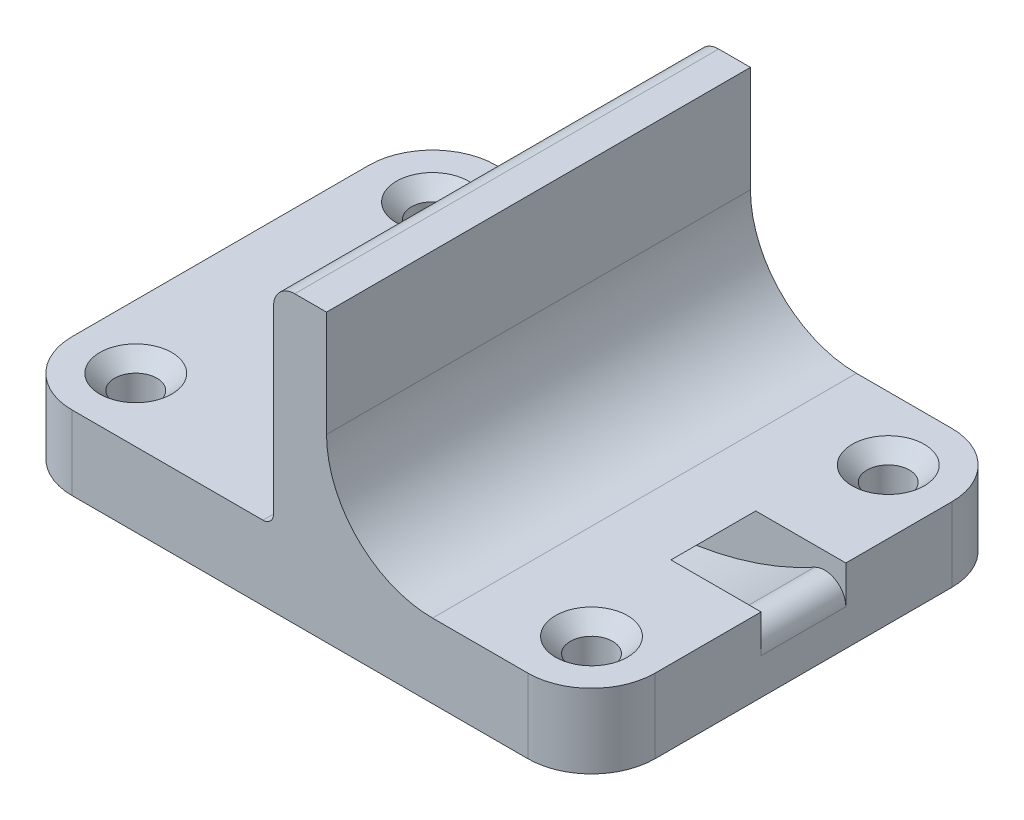
from build123d import *

# Parameters (mm, degrees)
BOSS_EXTRUDE1_DEPTH     = 40
CUT_EXTRUDE1_DEPTH      = 4
CUT_EXTRUDE1_DEPTH_BACK = 4
CUT_EXTRUDE1_START      = -20
SKETCH3_R               = 33.884102156
SKETCH3_R_2             = 29.884102156
FILLET1_R               = 2
FILLET2_R               = 2
FILLET3_R               = 2
SKETCH4_R               = 2
CUT_EXTRUDE2_DEPTH      = 7
CHAMFER1_SIZE           = 1.4
FILLET4_R               = 1
FILLET5_R               = 10
FILLET6_R               = 6


with BuildPart() as part:
    # Sketch1 → Boss-Extrude1 (new body)
    with BuildSketch(Plane.XY):
        Polygon((0, 0), (0, 20), (-5, 20), (-5, 0), (-30, 0), (-30, -7), (25, -7), (25, 0), align=None)
    extrude(amount=BOSS_EXTRUDE1_DEPTH)

    # Sketch3 → Cut-Extrude1 (cut, two sides: drawn at the far end of the back side and taken through both)
    with BuildSketch(Plane.XY.offset(40).offset(CUT_EXTRUDE1_START - CUT_EXTRUDE1_DEPTH_BACK)):
        with Locations((5.748786379, 27.884102156)):
            Circle(SKETCH3_R)
        with Locations((5.748786379, 27.884102156)):
            Circle(SKETCH3_R_2, mode=Mode.SUBTRACT)
    extrude(amount=CUT_EXTRUDE1_DEPTH + CUT_EXTRUDE1_DEPTH_BACK, mode=Mode.SUBTRACT)

    # Fillet1
    fillet1_edges = [part.edges().sort_by_distance(p)[0] for p in [
        (-5, 0, 20),
    ]]
    fillet(fillet1_edges, radius=FILLET1_R)

    # Fillet2
    fillet2_edges = [part.edges().sort_by_distance(p)[0] for p in [
        (-5, 20, 20),
    ]]
    fillet(fillet2_edges, radius=FILLET2_R)

    # Fillet3
    fillet3_edges = [part.edges().sort_by_distance(p)[0] for p in [
        (25, 0, 20),
    ]]
    fillet(fillet3_edges, radius=FILLET3_R)

    # Sketch4 → Cut-Extrude2 (cut)
    with BuildSketch(Plane(origin=(0, 0, 0), x_dir=(1, 0, 0), z_dir=(0, 1, 0))):
        with Locations(Location((-24, -6, 0), (0, 0, 180))):
            Circle(SKETCH4_R)
        with Locations(Location((-24, -34, 0), (0, 0, 180))):
            Circle(SKETCH4_R)
        with Locations(Location((19, -34, 0), (0, 0, 180))):
            Circle(SKETCH4_R)
        with Locations(Location((19, -6, 0), (0, 0, 180))):
            Circle(SKETCH4_R)
    extrude(amount=-CUT_EXTRUDE2_DEPTH, mode=Mode.SUBTRACT)

    # Chamfer1
    chamfer1_edges = [part.edges().sort_by_distance(p)[0] for p in [
        (21, 0, 6),
        (21, 0, 34),
        (-22, 0, 34),
        (-22, 0, 6),
    ]]
    chamfer(chamfer1_edges, length=CHAMFER1_SIZE)

    # Fillet4
    fillet4_edges = [part.edges().sort_by_distance(p)[0] for p in [
        (-5, 0, 32),
        (-5, 0, 8),
    ]]
    fillet(fillet4_edges, radius=FILLET4_R)

    # Fillet5
    fillet5_edges = [part.edges().sort_by_distance(p)[0] for p in [
        (0, 0, 20),
    ]]
    fillet(fillet5_edges, radius=FILLET5_R)

    # Fillet6
    fillet6_edges = [part.edges().sort_by_distance(p)[0] for p in [
        (-30, -3.5, 40),
        (25, -3.5, 40),
        (25, -3.5, 0),
        (-30, -3.5, 0),
    ]]
    fillet(fillet6_edges, radius=FILLET6_R)


solid = part.part
